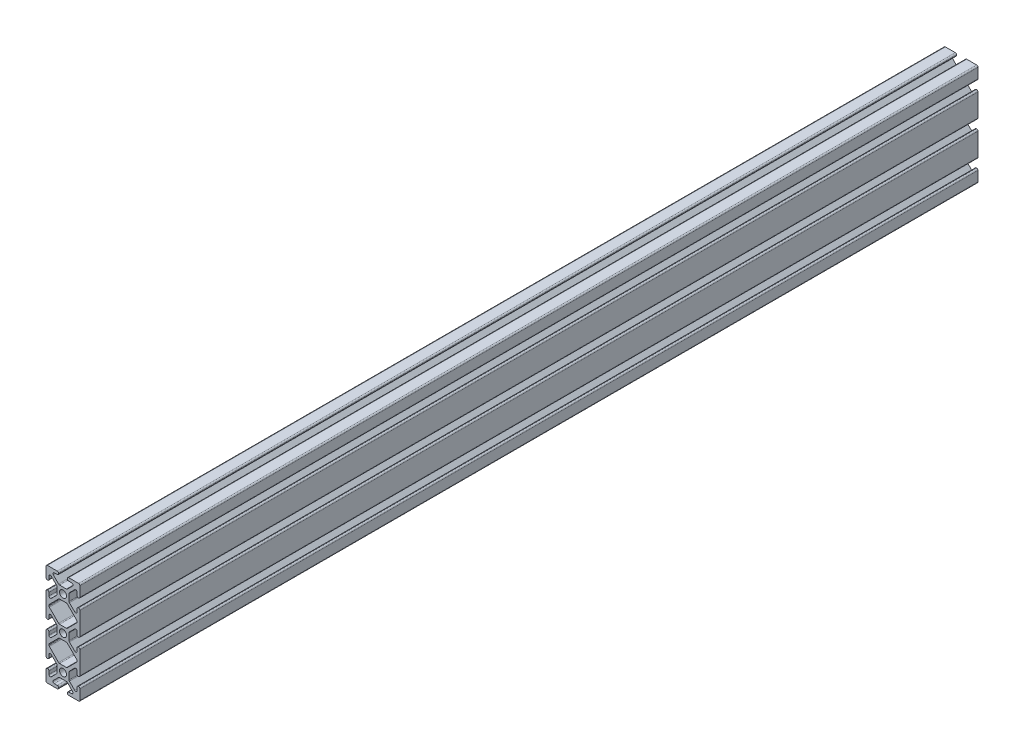
from build123d import *

# Parameters (mm, degrees)
SKETCH1_R            = 2.6035
MAIN_EXTRUSION_DEPTH = 335.6737


with BuildPart() as part:
    # Sketch1 → Main Extrusion (new, symmetric)
    with BuildSketch(Plane.XY):
        with BuildLine():
            Line((-12.7, 37.084), (-12.7, 29.6672))
            ThreePointArc((-12.7, 29.6672), (-12.40242049, 28.94877951), (-11.684, 28.6512))
            Line((-11.684, 28.6512), (-11.5062, 28.6512))
            ThreePointArc((-11.5062, 28.6512), (-10.78777951, 28.94877951), (-10.4902, 29.6672))
            Line((-10.4902, 29.6672), (-10.4902, 31.874794456))
            ThreePointArc((-10.4902, 31.874794456), (-9.863006367, 32.813456061), (-8.75577951, 32.593214945))
            Line((-8.75577951, 32.593214945), (-4.81877951, 28.656214945))
            ThreePointArc((-4.81877951, 28.656214945), (-4.598538395, 28.326600823), (-4.5212, 27.937794456))
            Line((-4.5212, 27.937794456), (-4.5212, 22.862205544))
            ThreePointArc((-4.5212, 22.862205544), (-4.598538395, 22.473399177), (-4.81877951, 22.143785055))
            Line((-4.81877951, 22.143785055), (-8.75577951, 18.206785055))
            ThreePointArc((-8.75577951, 18.206785055), (-9.863006367, 17.986543939), (-10.4902, 18.925205544))
            Line((-10.4902, 18.925205544), (-10.4902, 21.1328))
            ThreePointArc((-10.4902, 21.1328), (-10.78777951, 21.85122049), (-11.5062, 22.1488))
            Line((-11.5062, 22.1488), (-11.684, 22.1488))
            ThreePointArc((-11.684, 22.1488), (-12.40242049, 21.85122049), (-12.7, 21.1328))
            Line((-12.7, 21.1328), (-12.7, 4.2672))
            ThreePointArc((-12.7, 4.2672), (-12.40242049, 3.54877951), (-11.684, 3.2512))
            Line((-11.684, 3.2512), (-11.5062, 3.2512))
            ThreePointArc((-11.5062, 3.2512), (-10.78777951, 3.54877951), (-10.4902, 4.2672))
            Line((-10.4902, 4.2672), (-10.4902, 6.474794456))
            ThreePointArc((-10.4902, 6.474794456), (-9.863006367, 7.413456061), (-8.75577951, 7.193214945))
            Line((-8.75577951, 7.193214945), (-4.81877951, 3.256214945))
            ThreePointArc((-4.81877951, 3.256214945), (-4.598538395, 2.926600823), (-4.5212, 2.537794456))
            Line((-4.5212, 2.537794456), (-4.5212, -2.537794456))
            ThreePointArc((-4.5212, -2.537794456), (-4.598538395, -2.926600823), (-4.81877951, -3.256214945))
            Line((-4.81877951, -3.256214945), (-8.75577951, -7.193214945))
            ThreePointArc((-8.75577951, -7.193214945), (-9.863006367, -7.413456061), (-10.4902, -6.474794456))
            Line((-10.4902, -6.474794456), (-10.4902, -4.2672))
            ThreePointArc((-10.4902, -4.2672), (-10.78777951, -3.54877951), (-11.5062, -3.2512))
            Line((-11.5062, -3.2512), (-11.684, -3.2512))
            ThreePointArc((-11.684, -3.2512), (-12.40242049, -3.54877951), (-12.7, -4.2672))
            Line((-12.7, -4.2672), (-12.7, -21.1328))
            ThreePointArc((-12.7, -21.1328), (-12.40242049, -21.85122049), (-11.684, -22.1488))
            Line((-11.684, -22.1488), (-11.5062, -22.1488))
            ThreePointArc((-11.5062, -22.1488), (-10.78777951, -21.85122049), (-10.4902, -21.1328))
            Line((-10.4902, -21.1328), (-10.4902, -18.925205544))
            ThreePointArc((-10.4902, -18.925205544), (-9.863006367, -17.986543939), (-8.75577951, -18.206785055))
            Line((-8.75577951, -18.206785055), (-4.81877951, -22.143785055))
            ThreePointArc((-4.81877951, -22.143785055), (-4.598538395, -22.473399177), (-4.5212, -22.862205544))
            Line((-4.5212, -22.862205544), (-4.5212, -27.937794456))
            ThreePointArc((-4.5212, -27.937794456), (-4.598538395, -28.326600823), (-4.81877951, -28.656214945))
            Line((-4.81877951, -28.656214945), (-8.75577951, -32.593214945))
            ThreePointArc((-8.75577951, -32.593214945), (-9.863006367, -32.813456061), (-10.4902, -31.874794456))
            Line((-10.4902, -31.874794456), (-10.4902, -29.6672))
            ThreePointArc((-10.4902, -29.6672), (-10.78777951, -28.94877951), (-11.5062, -28.6512))
            Line((-11.5062, -28.6512), (-11.684, -28.6512))
            ThreePointArc((-11.684, -28.6512), (-12.40242049, -28.94877951), (-12.7, -29.6672))
            Line((-12.7, -29.6672), (-12.7, -37.084))
            ThreePointArc((-12.7, -37.084), (-12.40242049, -37.80242049), (-11.684, -38.1))
            Line((-11.684, -38.1), (-4.2672, -38.1))
            ThreePointArc((-4.2672, -38.1), (-3.54877951, -37.80242049), (-3.2512, -37.084))
            Line((-3.2512, -37.084), (-3.2512, -36.9062))
            ThreePointArc((-3.2512, -36.9062), (-3.54877951, -36.18777951), (-4.2672, -35.8902))
            Line((-4.2672, -35.8902), (-6.474794456, -35.8902))
            ThreePointArc((-6.474794456, -35.8902), (-7.413456061, -35.263006367), (-7.193214945, -34.15577951))
            Line((-7.193214945, -34.15577951), (-3.256214945, -30.21877951))
            ThreePointArc((-3.256214945, -30.21877951), (-2.926600823, -29.998538395), (-2.537794456, -29.9212))
            Line((-2.537794456, -29.9212), (2.537794456, -29.9212))
            ThreePointArc((2.537794456, -29.9212), (2.926600823, -29.998538395), (3.256214945, -30.21877951))
            Line((3.256214945, -30.21877951), (7.193214945, -34.15577951))
            ThreePointArc((7.193214945, -34.15577951), (7.413456061, -35.263006367), (6.474794456, -35.8902))
            Line((6.474794456, -35.8902), (4.2672, -35.8902))
            ThreePointArc((4.2672, -35.8902), (3.54877951, -36.18777951), (3.2512, -36.9062))
            Line((3.2512, -36.9062), (3.2512, -37.084))
            ThreePointArc((3.2512, -37.084), (3.54877951, -37.80242049), (4.2672, -38.1))
            Line((4.2672, -38.1), (11.684, -38.1))
            ThreePointArc((11.684, -38.1), (12.40242049, -37.80242049), (12.7, -37.084))
            Line((12.7, -37.084), (12.7, -29.6672))
            ThreePointArc((12.7, -29.6672), (12.40242049, -28.94877951), (11.684, -28.6512))
            Line((11.684, -28.6512), (11.5062, -28.6512))
            ThreePointArc((11.5062, -28.6512), (10.78777951, -28.94877951), (10.4902, -29.6672))
            Line((10.4902, -29.6672), (10.4902, -31.874794456))
            ThreePointArc((10.4902, -31.874794456), (9.863006367, -32.813456061), (8.75577951, -32.593214945))
            Line((8.75577951, -32.593214945), (4.81877951, -28.656214945))
            ThreePointArc((4.81877951, -28.656214945), (4.598538395, -28.326600823), (4.5212, -27.937794456))
            Line((4.5212, -27.937794456), (4.5212, -22.862205544))
            ThreePointArc((4.5212, -22.862205544), (4.598538395, -22.473399177), (4.81877951, -22.143785055))
            Line((4.81877951, -22.143785055), (8.75577951, -18.206785055))
            ThreePointArc((8.75577951, -18.206785055), (9.863006367, -17.986543939), (10.4902, -18.925205544))
            Line((10.4902, -18.925205544), (10.4902, -21.1328))
            ThreePointArc((10.4902, -21.1328), (10.78777951, -21.85122049), (11.5062, -22.1488))
            Line((11.5062, -22.1488), (11.684, -22.1488))
            ThreePointArc((11.684, -22.1488), (12.40242049, -21.85122049), (12.7, -21.1328))
            Line((12.7, -21.1328), (12.7, -4.2672))
            ThreePointArc((12.7, -4.2672), (12.40242049, -3.54877951), (11.684, -3.2512))
            Line((11.684, -3.2512), (11.5062, -3.2512))
            ThreePointArc((11.5062, -3.2512), (10.78777951, -3.54877951), (10.4902, -4.2672))
            Line((10.4902, -4.2672), (10.4902, -6.474794456))
            ThreePointArc((10.4902, -6.474794456), (9.863006367, -7.413456061), (8.75577951, -7.193214945))
            Line((8.75577951, -7.193214945), (4.81877951, -3.256214945))
            ThreePointArc((4.81877951, -3.256214945), (4.598538395, -2.926600823), (4.5212, -2.537794456))
            Line((4.5212, -2.537794456), (4.5212, 2.537794456))
            ThreePointArc((4.5212, 2.537794456), (4.598538395, 2.926600823), (4.81877951, 3.256214945))
            Line((4.81877951, 3.256214945), (8.75577951, 7.193214945))
            ThreePointArc((8.75577951, 7.193214945), (9.863006367, 7.413456061), (10.4902, 6.474794456))
            Line((10.4902, 6.474794456), (10.4902, 4.2672))
            ThreePointArc((10.4902, 4.2672), (10.78777951, 3.54877951), (11.5062, 3.2512))
            Line((11.5062, 3.2512), (11.684, 3.2512))
            ThreePointArc((11.684, 3.2512), (12.40242049, 3.54877951), (12.7, 4.2672))
            Line((12.7, 4.2672), (12.7, 21.1328))
            ThreePointArc((12.7, 21.1328), (12.40242049, 21.85122049), (11.684, 22.1488))
            Line((11.684, 22.1488), (11.5062, 22.1488))
            ThreePointArc((11.5062, 22.1488), (10.78777951, 21.85122049), (10.4902, 21.1328))
            Line((10.4902, 21.1328), (10.4902, 18.925205544))
            ThreePointArc((10.4902, 18.925205544), (9.863006367, 17.986543939), (8.75577951, 18.206785055))
            Line((8.75577951, 18.206785055), (4.81877951, 22.143785055))
            ThreePointArc((4.81877951, 22.143785055), (4.598538395, 22.473399177), (4.5212, 22.862205544))
            Line((4.5212, 22.862205544), (4.5212, 27.937794456))
            ThreePointArc((4.5212, 27.937794456), (4.598538395, 28.326600823), (4.81877951, 28.656214945))
            Line((4.81877951, 28.656214945), (8.75577951, 32.593214945))
            ThreePointArc((8.75577951, 32.593214945), (9.863006367, 32.813456061), (10.4902, 31.874794456))
            Line((10.4902, 31.874794456), (10.4902, 29.6672))
            ThreePointArc((10.4902, 29.6672), (10.78777951, 28.94877951), (11.5062, 28.6512))
            Line((11.5062, 28.6512), (11.684, 28.6512))
            ThreePointArc((11.684, 28.6512), (12.40242049, 28.94877951), (12.7, 29.6672))
            Line((12.7, 29.6672), (12.7, 37.084))
            ThreePointArc((12.7, 37.084), (12.40242049, 37.80242049), (11.684, 38.1))
            Line((11.684, 38.1), (4.2672, 38.1))
            ThreePointArc((4.2672, 38.1), (3.54877951, 37.80242049), (3.2512, 37.084))
            Line((3.2512, 37.084), (3.2512, 36.9062))
            ThreePointArc((3.2512, 36.9062), (3.54877951, 36.18777951), (4.2672, 35.8902))
            Line((4.2672, 35.8902), (6.474794456, 35.8902))
            ThreePointArc((6.474794456, 35.8902), (7.413456061, 35.263006367), (7.193214945, 34.15577951))
            Line((7.193214945, 34.15577951), (3.256214945, 30.21877951))
            ThreePointArc((3.256214945, 30.21877951), (2.926600823, 29.998538395), (2.537794456, 29.9212))
            Line((2.537794456, 29.9212), (-2.537794456, 29.9212))
            ThreePointArc((-2.537794456, 29.9212), (-2.926600823, 29.998538395), (-3.256214945, 30.21877951))
            Line((-3.256214945, 30.21877951), (-7.193214945, 34.15577951))
            ThreePointArc((-7.193214945, 34.15577951), (-7.413456061, 35.263006367), (-6.474794456, 35.8902))
            Line((-6.474794456, 35.8902), (-4.2672, 35.8902))
            ThreePointArc((-4.2672, 35.8902), (-3.54877951, 36.18777951), (-3.2512, 36.9062))
            Line((-3.2512, 36.9062), (-3.2512, 37.084))
            ThreePointArc((-3.2512, 37.084), (-3.54877951, 37.80242049), (-4.2672, 38.1))
            Line((-4.2672, 38.1), (-11.684, 38.1))
            ThreePointArc((-11.684, 38.1), (-12.40242049, 37.80242049), (-12.7, 37.084))
        make_face()
        with Locations((0, 25.4)):
            Circle(SKETCH1_R, mode=Mode.SUBTRACT)
        Circle(SKETCH1_R, mode=Mode.SUBTRACT)
        with Locations((0, -25.4)):
            Circle(SKETCH1_R, mode=Mode.SUBTRACT)
        with BuildLine():
            Line((-10.4902, 12.473605544), (-10.4902, 12.926394456))
            ThreePointArc((-10.4902, 12.926394456), (-10.412861605, 13.315200823), (-10.19262049, 13.644814945))
            Line((-10.19262049, 13.644814945), (-3.256214945, 20.58122049))
            ThreePointArc((-3.256214945, 20.58122049), (-2.926600823, 20.801461605), (-2.537794456, 20.8788))
            Line((-2.537794456, 20.8788), (2.537794456, 20.8788))
            ThreePointArc((2.537794456, 20.8788), (2.926600823, 20.801461605), (3.256214945, 20.58122049))
            Line((3.256214945, 20.58122049), (10.19262049, 13.644814945))
            ThreePointArc((10.19262049, 13.644814945), (10.412861605, 13.315200823), (10.4902, 12.926394456))
            Line((10.4902, 12.926394456), (10.4902, 12.473605544))
            ThreePointArc((10.4902, 12.473605544), (10.412861605, 12.084799177), (10.19262049, 11.755185055))
            Line((10.19262049, 11.755185055), (3.256214945, 4.81877951))
            ThreePointArc((3.256214945, 4.81877951), (2.926600823, 4.598538395), (2.537794456, 4.5212))
            Line((2.537794456, 4.5212), (-2.537794456, 4.5212))
            ThreePointArc((-2.537794456, 4.5212), (-2.926600823, 4.598538395), (-3.256214945, 4.81877951))
            Line((-3.256214945, 4.81877951), (-10.19262049, 11.755185055))
            ThreePointArc((-10.19262049, 11.755185055), (-10.412861605, 12.084799177), (-10.4902, 12.473605544))
        make_face(mode=Mode.SUBTRACT)
        with BuildLine():
            Line((-2.537794456, -4.5212), (2.537794456, -4.5212))
            ThreePointArc((2.537794456, -4.5212), (2.926600823, -4.598538395), (3.256214945, -4.81877951))
            Line((3.256214945, -4.81877951), (10.19262049, -11.755185055))
            ThreePointArc((10.19262049, -11.755185055), (10.412861605, -12.084799177), (10.4902, -12.473605544))
            Line((10.4902, -12.473605544), (10.4902, -12.926394456))
            ThreePointArc((10.4902, -12.926394456), (10.412861605, -13.315200823), (10.19262049, -13.644814945))
            Line((10.19262049, -13.644814945), (3.256214945, -20.58122049))
            ThreePointArc((3.256214945, -20.58122049), (2.926600823, -20.801461605), (2.537794456, -20.8788))
            Line((2.537794456, -20.8788), (-2.537794456, -20.8788))
            ThreePointArc((-2.537794456, -20.8788), (-2.926600823, -20.801461605), (-3.256214945, -20.58122049))
            Line((-3.256214945, -20.58122049), (-10.19262049, -13.644814945))
            ThreePointArc((-10.19262049, -13.644814945), (-10.412861605, -13.315200823), (-10.4902, -12.926394456))
            Line((-10.4902, -12.926394456), (-10.4902, -12.473605544))
            ThreePointArc((-10.4902, -12.473605544), (-10.412861605, -12.084799177), (-10.19262049, -11.755185055))
            Line((-10.19262049, -11.755185055), (-3.256214945, -4.81877951))
            ThreePointArc((-3.256214945, -4.81877951), (-2.926600823, -4.598538395), (-2.537794456, -4.5212))
        make_face(mode=Mode.SUBTRACT)
    extrude(amount=MAIN_EXTRUSION_DEPTH, both=True)


solid = part.part
